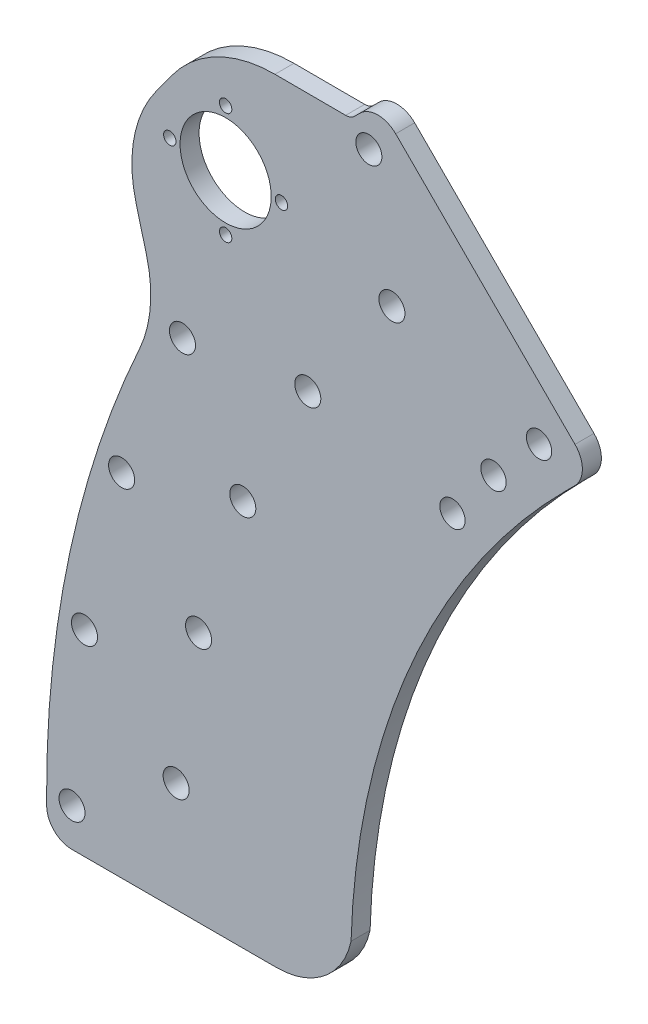
from build123d import *

# Parameters (mm, degrees)
SKETCH1_R           = 3.175
SKETCH1_R_2         = 3.2639
SKETCH1_R_3         = 1.55
SKETCH1_R_4         = 11.43
BOSS_EXTRUDE1_DEPTH = 4.7625
CUT_EXTRUDE1_DEPTH  = 322.291260875


with BuildPart() as part:
    # Sketch1 → Boss-Extrude1 (new body)
    with BuildSketch(Plane.XY):
        with BuildLine():
            Line((-260.35, 0), (-260.35, -3.2004))
            ThreePointArc((-260.35, -3.2004), (-258.497567548, -7.672567548), (-254.0254, -9.525))
            Line((-254.0254, -9.525), (-190.4746, -9.525))
            ThreePointArc((-190.4746, -9.525), (-186.002432452, -7.672567548), (-184.15, -3.2004))
            Line((-184.15, -3.2004), (-184.15, 0))
            ThreePointArc((-184.15, 0), (-170.132415912, 70.47115407), (-130.213713756, 130.213713756))
            Line((-130.213713756, 130.213713756), (-127.950689213, 132.476738298))
            ThreePointArc((-127.950689213, 132.476738298), (-126.098256761, 136.948905846), (-127.950689213, 141.421073395))
            Line((-127.950689213, 141.421073395), (-172.887890843, 186.358275024))
            ThreePointArc((-172.887890843, 186.358275024), (-177.360058391, 188.210707476), (-181.832225939, 186.358275024))
            Line((-181.832225939, 186.358275024), (-183.161638698, 185.028862266))
            ThreePointArc((-183.161638698, 185.028862266), (-184.195780986, 184.338914621), (-185.415571777, 184.098938684))
            Line((-185.415571777, 184.098938684), (-203.140946764, 184.148452962))
            ThreePointArc((-203.140946764, 184.148452962), (-217.580337842, 180.720298054), (-228.884291539, 171.104223407))
            Line((-228.884291539, 171.104223407), (-232.899485557, 165.597414859))
            ThreePointArc((-232.899485557, 165.597414859), (-238.444512868, 152.777545082), (-237.951278447, 138.818565579))
            Line((-237.951278447, 138.818565579), (-235.302655594, 128.744521776))
            ThreePointArc((-235.302655594, 128.744521776), (-234.372087536, 117.99517122), (-237.095069858, 107.554871341))
            ThreePointArc((-237.095069858, 107.554871341), (-254.469864559, 55.020092069), (-260.35, 0))
        make_face()
        with Locations(Location((-158.649272178, 111.08741631, 0), (0, 0, 180))):
            Circle(SKETCH1_R, mode=Mode.SUBTRACT)
        with Locations(Location((-148.363657521, 124.491890306, 0), (0, 0, 180))):
            Circle(SKETCH1_R, mode=Mode.SUBTRACT)
        with Locations(Location((-136.948905846, 136.948905846, 0), (0, 0, 180))):
            Circle(SKETCH1_R, mode=Mode.SUBTRACT)
        with Locations(Location((-227.895302491, 17.935749283, 0), (0, 0, 180))):
            Circle(SKETCH1_R_2, mode=Mode.SUBTRACT)
        with Locations(Location((-222.283763803, 53.365610177, 0), (0, 0, 180))):
            Circle(SKETCH1_R_2, mode=Mode.SUBTRACT)
        with Locations(Location((-211.198861132, 87.481432639, 0), (0, 0, 180))):
            Circle(SKETCH1_R_2, mode=Mode.SUBTRACT)
        with Locations(Location((-194.913541571, 119.443171894, 0), (0, 0, 180))):
            Circle(SKETCH1_R_2, mode=Mode.SUBTRACT)
        with Locations(Location((-173.828803736, 148.463823848, 0), (0, 0, 180))):
            Circle(SKETCH1_R_2, mode=Mode.SUBTRACT)
        with Locations(Location((-215.499095978, 171.127431131, 0), (0, 0, 180))):
            Circle(SKETCH1_R_3, mode=Mode.SUBTRACT)
        with Locations(Location((-201.499096038, 157.127431191, 0), (0, 0, 180))):
            Circle(SKETCH1_R_3, mode=Mode.SUBTRACT)
        with Locations(Location((-215.499095978, 143.127431251, 0), (0, 0, 180))):
            Circle(SKETCH1_R_3, mode=Mode.SUBTRACT)
        with Locations(Location((-229.499095918, 157.127431191, 0), (0, 0, 180))):
            Circle(SKETCH1_R_3, mode=Mode.SUBTRACT)
        with Locations(Location((-215.499095978, 157.127431191, 0), (0, 0, 180))):
            Circle(SKETCH1_R_4, mode=Mode.SUBTRACT)
        with Locations(Location((-254, 0, 0), (0, 0, 180))):
            Circle(SKETCH1_R_2, mode=Mode.SUBTRACT)
        with Locations(Location((-250.872838511, 39.73435412, 0), (0, 0, 180))):
            Circle(SKETCH1_R_2, mode=Mode.SUBTRACT)
        with Locations(Location((-241.568355139, 78.490316571, 0), (0, 0, 180))):
            Circle(SKETCH1_R_2, mode=Mode.SUBTRACT)
        with Locations(Location((-226.315657144, 115.313586934, 0), (0, 0, 180))):
            Circle(SKETCH1_R_2, mode=Mode.SUBTRACT)
        with Locations(Location((-179.605122421, 179.605122421, 0), (0, 0, 180))):
            Circle(SKETCH1_R_2, mode=Mode.SUBTRACT)
    extrude(amount=BOSS_EXTRUDE1_DEPTH)

    # Sketch2 → Cut-Extrude1 (cut, through all)
    with BuildSketch(Plane.XY.offset(4.7625)):
        with BuildLine():
            Line((-202.692, -9.525), (-183.642, -9.525))
            Line((-183.642, -9.525), (-183.642, 9.525))
            ThreePointArc((-183.642, 9.525), (-189.221615818, -3.945384182), (-202.692, -9.525))
        make_face()
    extrude(amount=-CUT_EXTRUDE1_DEPTH, mode=Mode.SUBTRACT)


solid = part.part
